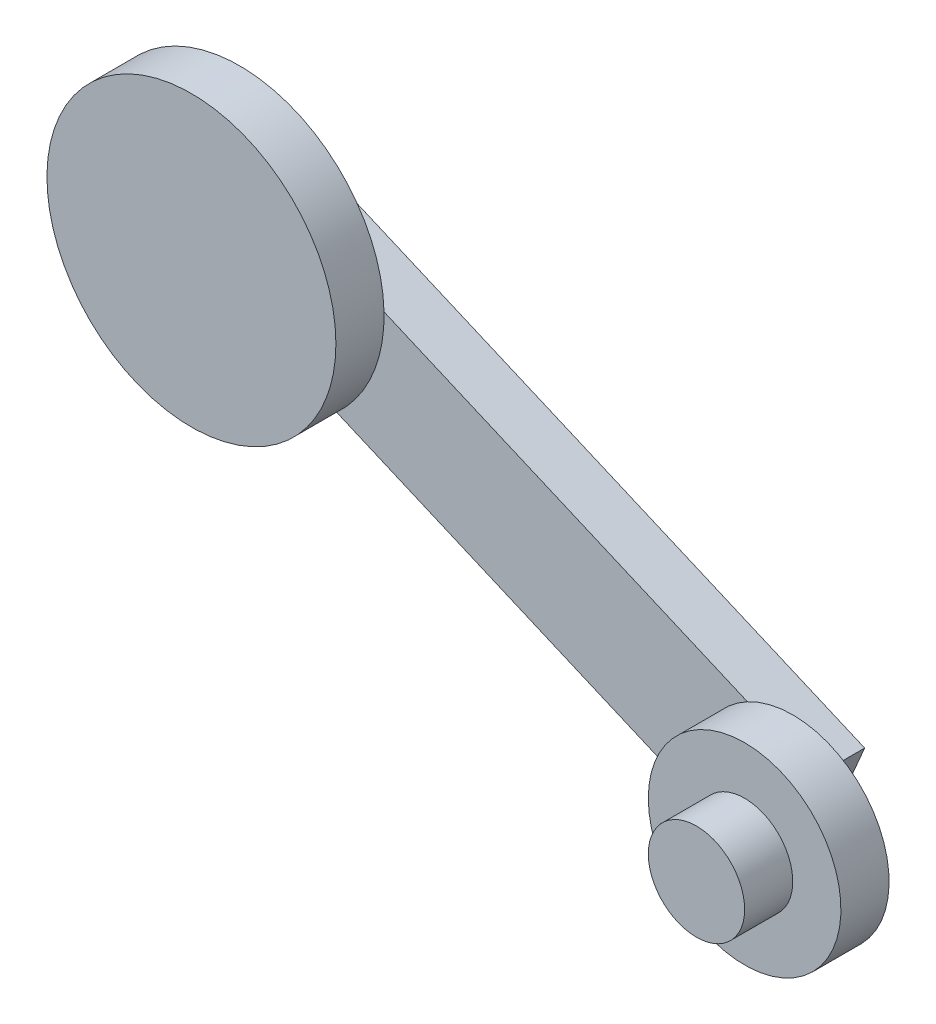
from build123d import *

# Parameters (mm, degrees)
SKETCH1_R           = 2
BOSS_EXTRUDE1_DEPTH = 2
SKETCH2_R           = 4
BOSS_EXTRUDE2_DEPTH = 2
BOSS_EXTRUDE3_DEPTH = 2
SKETCH4_R           = 6
BOSS_EXTRUDE4_DEPTH = 2


with BuildPart() as part:
    # Sketch1 → Boss-Extrude1 (new body)
    with BuildSketch(Plane.XY):
        Circle(SKETCH1_R)
    extrude(amount=BOSS_EXTRUDE1_DEPTH)

    # Sketch2 → Boss-Extrude2 (add)
    with BuildSketch(Plane(origin=(0, 0, 0), x_dir=(-1, 0, 0), z_dir=(0, 0, -1))):
        Circle(SKETCH2_R)
    extrude(amount=BOSS_EXTRUDE2_DEPTH)

    # Sketch3 → Boss-Extrude3 (add)
    with BuildSketch(Plane(origin=(0, 0, -2), x_dir=(-1, 0, 0), z_dir=(0, 0, -1))):
        Polygon((21.988055025, 12.156292042), (-0.985889756, 2.297394478), (0.985889756, -2.297394478), (23.959834538, 7.561503086), align=None)
    extrude(amount=BOSS_EXTRUDE3_DEPTH)

    # Sketch4 → Boss-Extrude4 (add)
    with BuildSketch(Plane.XY.offset(-2)):
        with Locations(Location((-22.973944782, 9.858897564, 0), (0, 0, 312.149872239))):
            Circle(SKETCH4_R)
    extrude(amount=BOSS_EXTRUDE4_DEPTH)


solid = part.part
